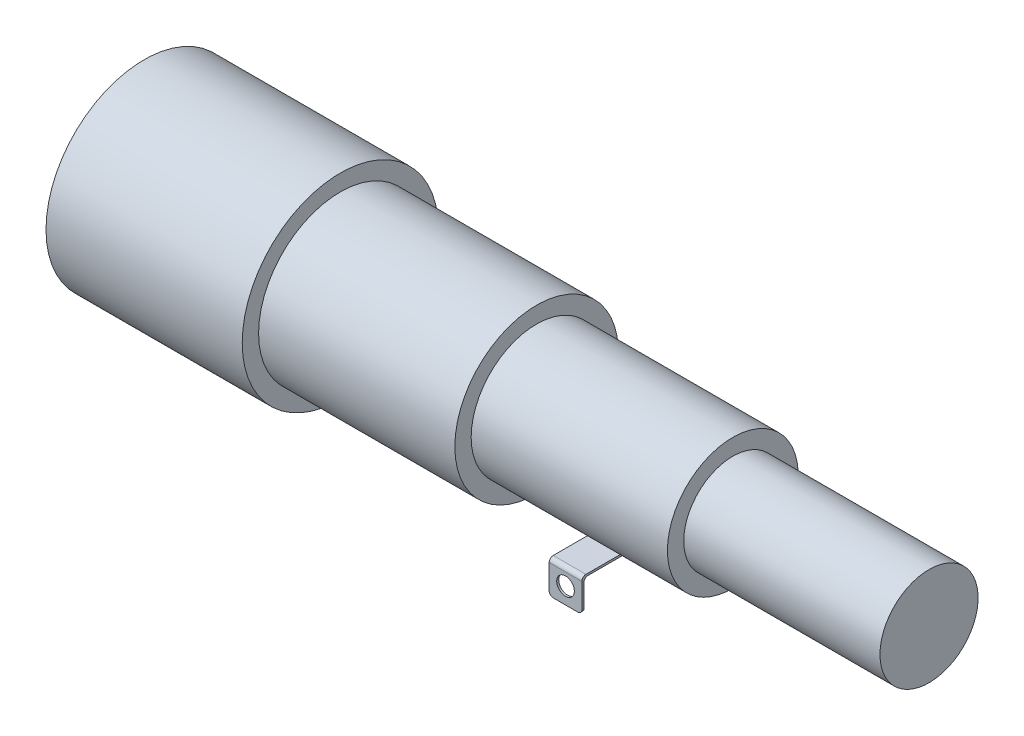
from build123d import *

# Parameters (mm, degrees)
SKETCH1_R               = 152.4
BOSS_EXTRUDE1_DEPTH     = 304.8
SKETCH2_R               = 127
BOSS_EXTRUDE2_DEPTH     = 304.8
SKETCH3_R               = 101.6
BOSS_EXTRUDE3_DEPTH     = 304.8
SKETCH4_R               = 76.2
BOSS_EXTRUDE4_DEPTH     = 304.8
BOSS_EXTRUDE6_DEPTH     = 25.4
FILLET1_R               = 6.35
CUT_EXTRUDE1_DEPTH      = 1255.641741745
CUT_EXTRUDE1_DEPTH_BACK = 1255.641741745
SKETCH7_R               = 13.716


with BuildPart() as part:
    # Sketch1 → Boss-Extrude1 (new body)
    with BuildSketch(Plane(origin=(0, 0, 0), x_dir=(0, 0, -1), z_dir=(1, 0, 0))):
        with Locations(Location((0, 0, 0), (0, 0, 180))):
            Circle(SKETCH1_R)
    extrude(amount=BOSS_EXTRUDE1_DEPTH)

    # Sketch2 → Boss-Extrude2 (add)
    with BuildSketch(Plane(origin=(304.8, 0, 0), x_dir=(0, 0, -1), z_dir=(1, 0, 0))):
        with Locations(Location((0, 0, 0), (0, 0, 180))):
            Circle(SKETCH2_R)
    extrude(amount=BOSS_EXTRUDE2_DEPTH)

    # Sketch3 → Boss-Extrude3 (add)
    with BuildSketch(Plane(origin=(609.6, 0, 0), x_dir=(0, 0, -1), z_dir=(1, 0, 0))):
        with Locations(Location((0, 0, 0), (0, 0, 180))):
            Circle(SKETCH3_R)
    extrude(amount=BOSS_EXTRUDE3_DEPTH)

    # Sketch4 → Boss-Extrude4 (add)
    with BuildSketch(Plane(origin=(914.4, 0, 0), x_dir=(0, 0, -1), z_dir=(1, 0, 0))):
        with Locations(Location((0, 0, 0), (0, 0, 180))):
            Circle(SKETCH4_R)
    extrude(amount=BOSS_EXTRUDE4_DEPTH)


with BuildPart() as body_2:
    # Sketch6 → Boss-Extrude6 (new, symmetric)
    with BuildSketch(Plane.ZY.offset(-756.033019333)):
        Polygon((101.473, -101.6), (-101.473, -101.6), (-101.473, -152.4), (-98.298, -152.4), (-98.298, -104.775), (98.298, -104.775), (98.298, -152.4), (101.473, -152.4), align=None)
    extrude(amount=BOSS_EXTRUDE6_DEPTH, both=True)

    # Fillet1
    fillet1_edges = [body_2.edges().sort_by_distance(p)[0] for p in [
        (781.433019333, -152.4, 99.8855),
        (756.033019333, -104.775, 98.298),
        (756.033019333, -104.775, -98.298),
        (756.033019333, -101.6, -101.473),
        (756.033019333, -101.6, 101.473),
        (730.633019333, -152.4, -99.8855),
        (730.633019333, -152.4, 99.8855),
        (781.433019333, -152.4, -99.8855),
    ]]
    fillet(fillet1_edges, radius=FILLET1_R)

    # Sketch7 → Cut-Extrude1 (cut, two sides: drawn at the far end of the back side and taken through both)
    with BuildSketch(Plane.XY.offset(101.473).offset(-CUT_EXTRUDE1_DEPTH_BACK)):
        with Locations((756.033019333, -127)):
            Circle(SKETCH7_R)
    extrude(amount=CUT_EXTRUDE1_DEPTH + CUT_EXTRUDE1_DEPTH_BACK, mode=Mode.SUBTRACT)


solid = Compound([part.part, body_2.part])
